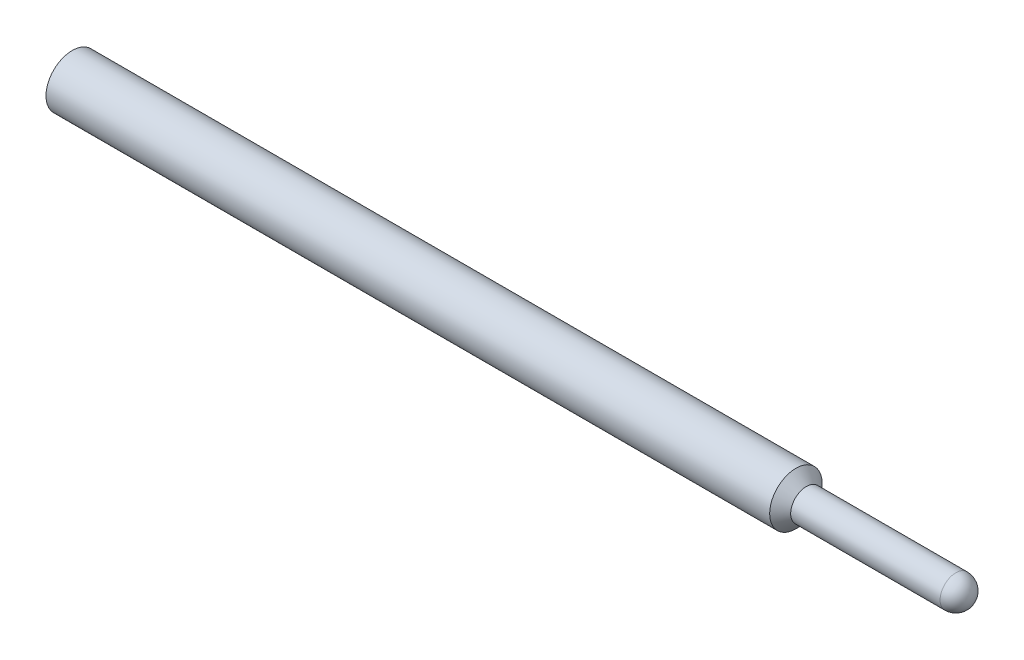
from build123d import *


with BuildPart() as part:
    # Sketch1 → Revolve1 (revolve)
    with BuildSketch(Plane.XY, mode=Mode.PRIVATE) as revolve1_sk:
        with BuildLine():
            Line((0, 0), (0, 10))
            Line((0, 10), (276, 10))
            Line((276, 10), (280, 6))
            Line((280, 6), (337, 6))
            ThreePointArc((337, 6), (341.242640687, 4.242640687), (343, 0))
            Line((343, 0), (0, 0))
        make_face()
    revolve(revolve1_sk.sketch.rotate(Axis((0, 0, 0), (1, 0, 0)), 180), axis=Axis((0, 0, 0), (1, 0, 0)))


solid = part.part
